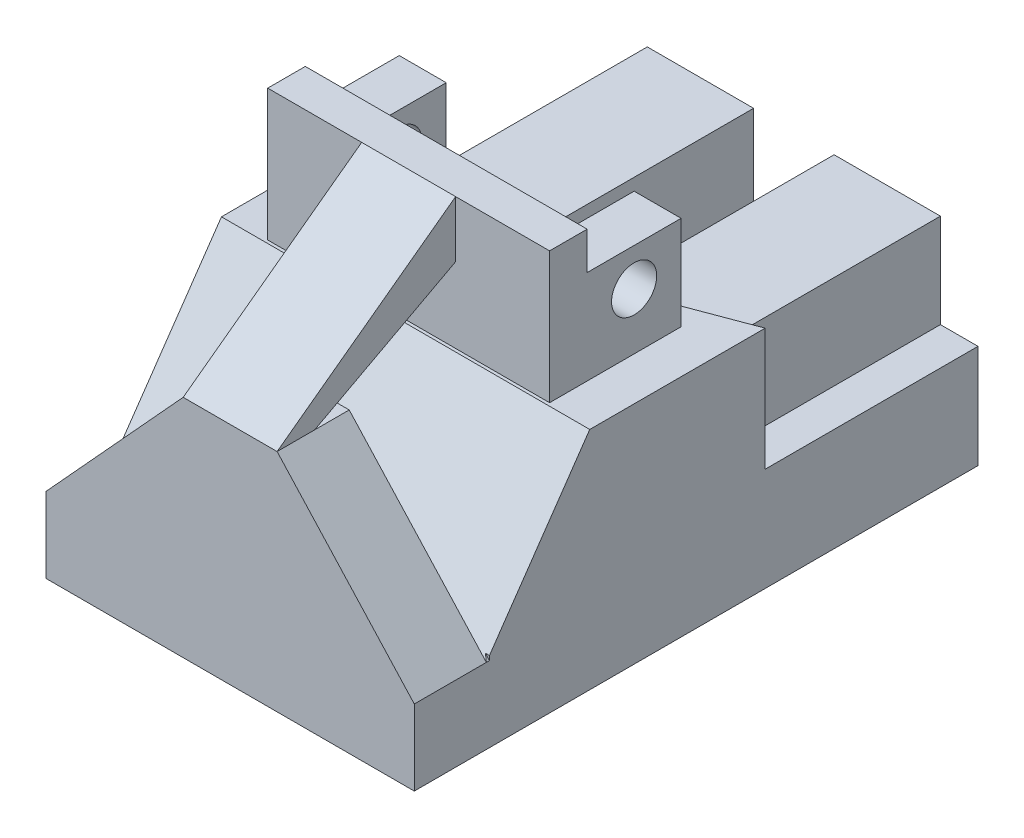
from build123d import *

# Parameters (mm, degrees)
BOSS_EXTRUDE2_DEPTH      = 10
BOSS_EXTRUDE2_DEPTH_BACK = 10
SKETCH2_W                = 30
SKETCH2_H                = 12
SKETCH11_W               = 2.5
SKETCH11_H               = 5
BOSS_EXTRUDE5_DEPTH      = 5
SKETCH12_R               = 1.2
CUT_EXTRUDE3_DEPTH       = 5
SKETCH13_W               = 15
SKETCH13_H               = 2
BOSS_EXTRUDE6_DEPTH      = 7
SKETCH16_W               = 30
SKETCH16_H               = 12
CUT_EXTRUDE4_DEPTH       = 0.2
CUT_EXTRUDE5_DEPTH       = 1.5
CUT_EXTRUDE6_DEPTH       = 31
SKETCH23_W               = 4.283577098
SKETCH23_H               = 14.196829294
CUT_EXTRUDE7_DEPTH       = 5
SKETCH24_W               = 2
SKETCH24_H               = 11.325
CUT_EXTRUDE8_DEPTH       = 5
CUT_EXTRUDE9_DEPTH       = 4


with BuildPart() as part:
    # Sketch2 → Boss-Extrude2 (new, two sides: drawn at the far end of the back side and taken through both)
    with BuildSketch(Plane(origin=(0, 0, 0), x_dir=(0, 0, -1), z_dir=(1, 0, 0)).offset(-BOSS_EXTRUDE2_DEPTH_BACK)):
        with Locations((15, 6)):
            Rectangle(SKETCH2_W, SKETCH2_H)
    extrude(amount=BOSS_EXTRUDE2_DEPTH + BOSS_EXTRUDE2_DEPTH_BACK)

    # Sketch11 → Boss-Extrude5 (add)
    with BuildSketch(Plane(origin=(0, 12, 0), x_dir=(1, 0, 0), z_dir=(0, 1, 0))):
        with Locations((-6.25, 14)):
            Rectangle(SKETCH11_W, SKETCH11_H)
    boss_extrude5 = extrude(amount=BOSS_EXTRUDE5_DEPTH)

    # Sketch12 → Cut-Extrude3 (cut)
    with BuildSketch(Plane(origin=(-5, 0, 0), x_dir=(0, 0, -1), z_dir=(1, 0, 0))):
        with Locations((14, 15)):
            Circle(SKETCH12_R)
    cut_extrude3 = extrude(amount=-CUT_EXTRUDE3_DEPTH, mode=Mode.SUBTRACT)

    # Mirror2: Boss-Extrude5, Cut-Extrude3 across plane
    add(boss_extrude5.mirror(Plane.ZY))
    add(cut_extrude3.mirror(Plane.ZY), mode=Mode.SUBTRACT)

    # Sketch13 → Boss-Extrude6 (add)
    with BuildSketch(Plane(origin=(0, 12, 0), x_dir=(1, 0, 0), z_dir=(0, 1, 0))):
        with Locations((0, 10.5)):
            Rectangle(SKETCH13_W, SKETCH13_H)
    extrude(amount=BOSS_EXTRUDE6_DEPTH)

    # Sketch16 → Cut-Extrude4 (cut)
    with BuildSketch(Plane(origin=(10, 0, 0), x_dir=(0, 0, -1), z_dir=(1, 0, 0))):
        with Locations((15, 6)):
            Rectangle(SKETCH16_W, SKETCH16_H)
    cut_extrude4 = extrude(amount=-CUT_EXTRUDE4_DEPTH, mode=Mode.SUBTRACT)

    # Mirror3: Cut-Extrude4 across plane
    add(cut_extrude4.mirror(Plane.ZY), mode=Mode.SUBTRACT)

    # Sketch5 → Cut-Extrude5 (cut)
    with BuildSketch(Plane(origin=(0, 12, 0), x_dir=(1, 0, 0), z_dir=(0, 1, 0))):
        Polygon((-10, 18.75), (-10, 30), (10, 30), (10, 18.75), (0, 15), align=None)
    extrude(amount=-CUT_EXTRUDE5_DEPTH, mode=Mode.SUBTRACT)

    # Sketch20 → Loft1 section 0
    with BuildSketch(Plane(origin=(0, 12, 0), x_dir=(1, 0, 0), z_dir=(0, 1, 0))):
        with BuildLine():
            Line((-2.5, 2), (2.5, 2))
            Line((2.5, 2), (2.5, 0))
            Line((2.5, 0), (-2.5, 0))
            Line((-2.5, 0), (-2.5, 2))
        make_face()
    # Sketch19 → Loft1 section 1
    with BuildSketch(Plane.XY.offset(-9.5)):
        with BuildLine():
            Line((2.5, 16), (-2.5, 16))
            Line((-2.5, 16), (-2.5, 19))
            Line((-2.5, 19), (2.5, 19))
            Line((2.5, 19), (2.5, 16))
        make_face()
    loft()

    # Sketch22 → Cut-Extrude6 (cut)
    with BuildSketch(Plane.ZY.offset(9.8)):
        Polygon((-9.3375, 12), (-3.836516703, 4.014793252), (-3.836516703, 12), align=None)
    extrude(amount=-CUT_EXTRUDE6_DEPTH, mode=Mode.SUBTRACT)

    # Sketch23 → Cut-Extrude7 (cut)
    with BuildSketch(Plane(origin=(0, 10.5, 0), x_dir=(1, 0, 0), z_dir=(0, 1, 0))):
        with Locations((0, 22.901585353)):
            Rectangle(SKETCH23_W, SKETCH23_H)
    extrude(amount=-CUT_EXTRUDE7_DEPTH, mode=Mode.SUBTRACT)

    # Sketch24 → Cut-Extrude8 (cut)
    with BuildSketch(Plane(origin=(0, 10.5, 0), x_dir=(1, 0, 0), z_dir=(0, 1, 0))):
        with Locations((8.8, 24.3375)):
            Rectangle(SKETCH24_W, SKETCH24_H)
    cut_extrude8 = extrude(amount=-CUT_EXTRUDE8_DEPTH, mode=Mode.SUBTRACT)

    # Mirror4: Cut-Extrude8 across plane
    add(cut_extrude8.mirror(Plane.ZY), mode=Mode.SUBTRACT)

    # Sketch25 → Cut-Extrude9 (cut)
    with BuildSketch(Plane.XY):
        Polygon((-9.8, 12), (-9.8, 4.014793252), (-2.5, 12), align=None)
    cut_extrude9 = extrude(amount=-CUT_EXTRUDE9_DEPTH, mode=Mode.SUBTRACT)

    # Mirror5: Cut-Extrude9 across plane
    add(cut_extrude9.mirror(Plane.ZY), mode=Mode.SUBTRACT)


solid = part.part
